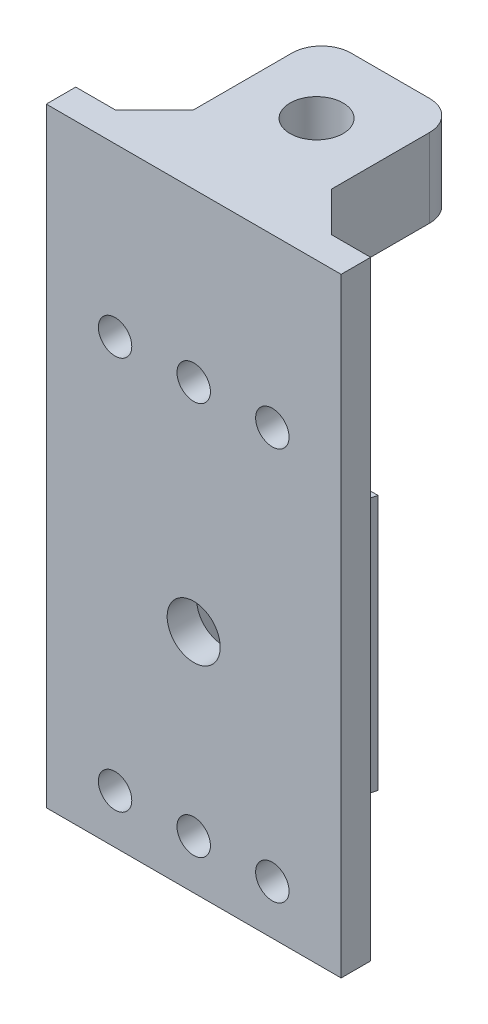
from build123d import *

# Parameters (mm, degrees)
SKETCH_1_R          = 1.7
SKETCH_1_R_2        = 2.7
EXTRUDE_1_DEPTH     = 3
SKETCH_3_W          = 14
SKETCH_3_H          = 8
EXTRUDE_2_DEPTH     = 17
CUT_EXTRUDE_1_DEPTH = 4
CUT_EXTRUDE_2_REACH = 64.274
SKETCH_6_R          = 2.7
FILLET_1_R          = 3
CHAMFER_1_SIZE      = 4
SKETCH_7_W          = 6.9
SKETCH_7_H          = 26
EXTRUDE_3_DEPTH     = 3.4
EXTRUDE_4_DEPTH     = 26


with BuildPart() as part:
    # 草图1 → 凸台-拉伸1 (new body)
    with BuildSketch(Plane.XY):
        Polygon((-15, 27), (-15, -23), (15, -23), (15, 27), (15, 39), (-15, 39), align=None)
        with Locations((-8, -18)):
            Circle(SKETCH_1_R, mode=Mode.SUBTRACT)
        with Locations((0, -18)):
            Circle(SKETCH_1_R, mode=Mode.SUBTRACT)
        with Locations((8, -18)):
            Circle(SKETCH_1_R, mode=Mode.SUBTRACT)
        with Locations((-8, 22)):
            Circle(SKETCH_1_R, mode=Mode.SUBTRACT)
        Circle(SKETCH_1_R_2, mode=Mode.SUBTRACT)
        with Locations((0, 22)):
            Circle(SKETCH_1_R, mode=Mode.SUBTRACT)
        with Locations((8, 22)):
            Circle(SKETCH_1_R, mode=Mode.SUBTRACT)
    extrude(amount=EXTRUDE_1_DEPTH)

    # 草图3 → 凸台-拉伸2 (add)
    with BuildSketch(Plane(origin=(0, 0, 0), x_dir=(-1, 0, 0), z_dir=(0, 0, -1))):
        with Locations((0, 35)):
            Rectangle(SKETCH_3_W, SKETCH_3_H)
    extrude(amount=EXTRUDE_2_DEPTH)

    # 草图5 → 切除-拉伸1 (cut)
    with BuildSketch(Plane.XZ.offset(-31)):
        Polygon((4, -11.809401077), (4, -7.190598923), (0, -4.881197846), (-4, -7.190598923), (-4, -11.809401077), (0, -14.118802154), align=None)
    extrude(amount=-CUT_EXTRUDE_1_DEPTH, mode=Mode.SUBTRACT)

    # 草图6 → 切除-拉伸2 (cut, up to next)
    with BuildSketch(Plane.XZ.offset(-35), mode=Mode.PRIVATE) as cut_extrude_2_sk1:
        with Locations(Location((0, -9.5, 0), (0, 0, 270))):
            Circle(SKETCH_6_R)
    cut_extrude_2_tool1 = extrude(cut_extrude_2_sk1.sketch, amount=-CUT_EXTRUDE_2_REACH, mode=Mode.PRIVATE) & part.part
    add(cut_extrude_2_tool1.solids().sort_by_distance((0, 35, -9.5))[0], mode=Mode.SUBTRACT)

    # 圆角1
    fillet_1_edges = [part.edges().sort_by_distance(p)[0] for p in [
        (-7, 35, -17),
        (7, 35, -17),
    ]]
    fillet(fillet_1_edges, radius=FILLET_1_R)

    # 倒角1
    chamfer_1_edges = [part.edges().sort_by_distance(p)[0] for p in [
        (-7, 35, 0),
        (7, 35, 0),
    ]]
    chamfer(chamfer_1_edges, length=CHAMFER_1_SIZE)

    # 草图7 → 凸台-拉伸3 (add)
    with BuildSketch(Plane(origin=(0, 0, 0), x_dir=(-1, 0, 0), z_dir=(0, 0, -1))):
        with Locations((-8, 2)):
            Rectangle(SKETCH_7_W, SKETCH_7_H)
        with Locations((8, 2)):
            Rectangle(SKETCH_7_W, SKETCH_7_H)
    extrude(amount=EXTRUDE_3_DEPTH)

    # 草图8 → 凸台-拉伸4 (add)
    with BuildSketch(Plane(origin=(0, 15, 0), x_dir=(1, 0, 0), z_dir=(0, 1, 0))):
        Polygon((11.45, 0), (11.45, 3.4), (12.35, 3.4), align=None)
        Polygon((3.65, 3.4), (4.55, 0), (4.55, 3.4), align=None)
        Polygon((-12.35, 3.4), (-11.45, 0), (-11.45, 3.4), align=None)
        Polygon((-4.55, 0), (-4.55, 3.4), (-3.65, 3.4), align=None)
    extrude(amount=-EXTRUDE_4_DEPTH)


solid = part.part
